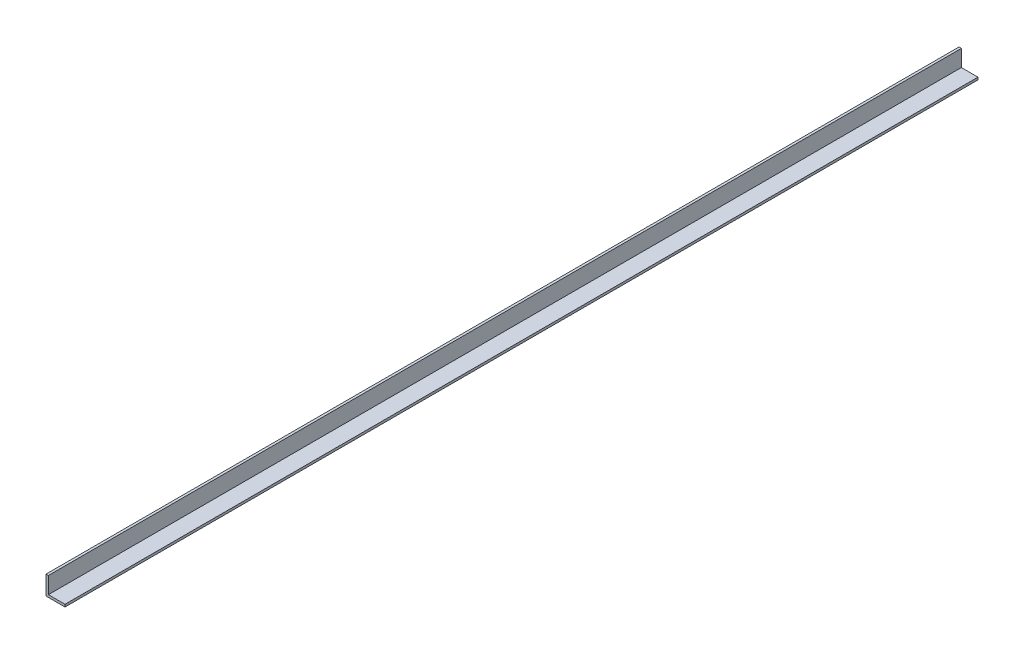
from build123d import *

# Parameters (mm, degrees)
BOSS_EXTRUDE1_DEPTH = 609.6


with BuildPart() as part:
    # Sketch1 → Boss-Extrude1 (new body)
    with BuildSketch(Plane.XY):
        Polygon((0, 1.6002), (0, 0), (1.6002, 0), (12.7, 0), (12.7, 1.6002), (1.6002, 1.6002), (1.6002, 12.7), (0, 12.7), align=None)
    extrude(amount=BOSS_EXTRUDE1_DEPTH)


solid = part.part
